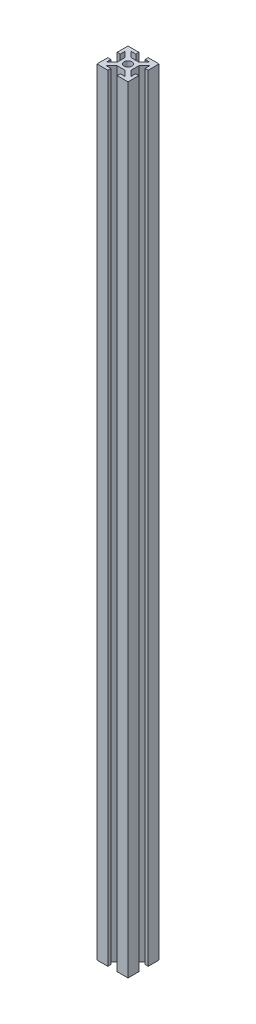
from build123d import *

# Parameters (mm, degrees)
CROQUIS1_R              = 2.5
SALIENTE_EXTRUIR1_DEPTH = 500


with BuildPart() as part:
    # Croquis1 → Saliente-Extruir1 (new body)
    with BuildSketch(Plane(origin=(0, 0, 0), x_dir=(1, 0, 0), z_dir=(0, 1, 0))):
        Polygon((3, 10), (3, 8), (6, 8), (2.5, 4.5), (-2.5, 4.5), (-6, 8), (-3, 8), (-3, 10), (-10, 10), (-10, 3), (-8, 3), (-8, 6), (-4.5, 2.5), (-4.5, -2.5), (-8, -6), (-8, -3), (-10, -3), (-10, -10), (-3, -10), (-3, -8), (-6, -8), (-2.5, -4.5), (2.5, -4.5), (6, -8), (3, -8), (3, -10), (10, -10), (10, -3), (8, -3), (8, -6), (4.5, -2.5), (4.5, 2.5), (8, 6), (8, 3), (10, 3), (10, 10), align=None)
        with Locations(Location((0, 0, 0), (0, 0, 270))):
            Circle(CROQUIS1_R, mode=Mode.SUBTRACT)
    extrude(amount=SALIENTE_EXTRUIR1_DEPTH)


solid = part.part
